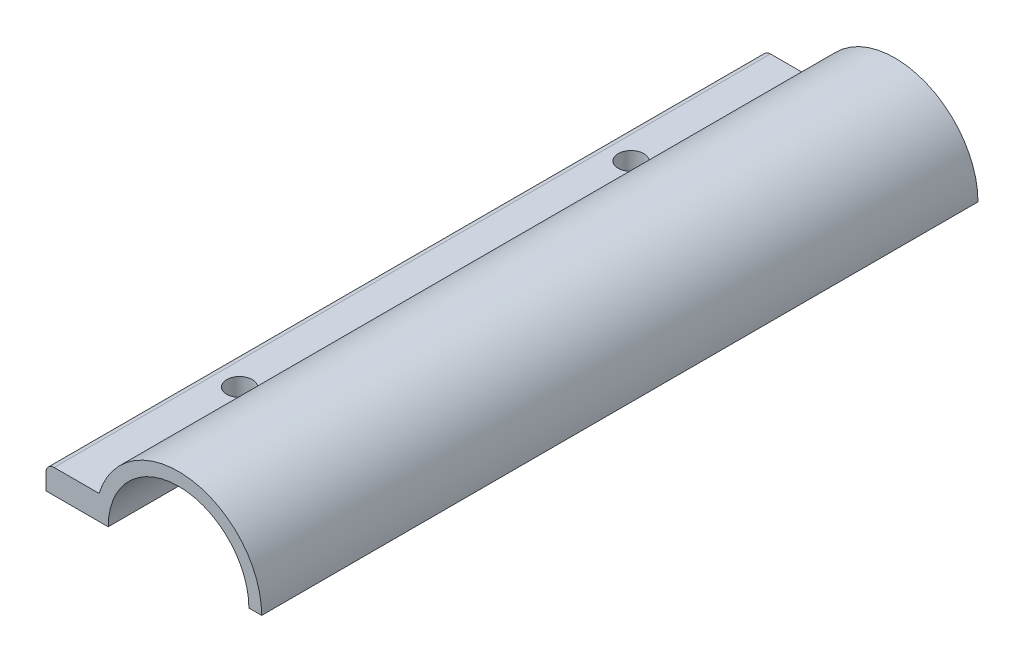
from build123d import *

# Parameters (mm, degrees)
BOSS_EXTRUDE1_DEPTH = 112
SKETCH3_R           = 2
CUT_EXTRUDE2_DEPTH  = 115.271427971
FILLET1_R           = 1.27


with BuildPart() as part:
    # Sketch1 → Boss-Extrude1 (new body)
    with BuildSketch(Plane.XY):
        with BuildLine():
            ThreePointArc((-12.429155241, 3.81), (-12.856496765, 1.926263465), (-13, 0))
            Line((-13, 0), (-11, 0))
            ThreePointArc((-11, 0), (0, 11), (11, 0))
            Line((11, 0), (13, 0))
            ThreePointArc((13, 0), (9.192388155, 9.192388155), (0, 13))
            ThreePointArc((0, 13), (-7.728842087, 10.452990003), (-12.429155241, 3.81))
        make_face()
        with BuildLine():
            Line((-20.724457785, 0), (-13, 0))
            ThreePointArc((-13, 0), (-12.856496765, 1.926263465), (-12.429155241, 3.81))
            Line((-12.429155241, 3.81), (-20.724457785, 3.81))
            Line((-20.724457785, 3.81), (-20.724457785, 0))
        make_face()
    extrude(amount=BOSS_EXTRUDE1_DEPTH)

    # Sketch3 → Cut-Extrude2 (cut, through all)
    with BuildSketch(Plane(origin=(0, 3.81, 0), x_dir=(1, 0, 0), z_dir=(0, 1, 0))):
        with Locations(Location((-15.862228893, -25.4, 0), (0, 0, 270))):
            Circle(SKETCH3_R)
        with Locations(Location((-15.862228893, -86.6, 0), (0, 0, 270))):
            Circle(SKETCH3_R)
    extrude(amount=-CUT_EXTRUDE2_DEPTH, mode=Mode.SUBTRACT)

    # Fillet1
    fillet1_edges = [part.edges().sort_by_distance(p)[0] for p in [
        (-20.724457785, 3.81, 56),
    ]]
    fillet(fillet1_edges, radius=FILLET1_R)


solid = part.part
